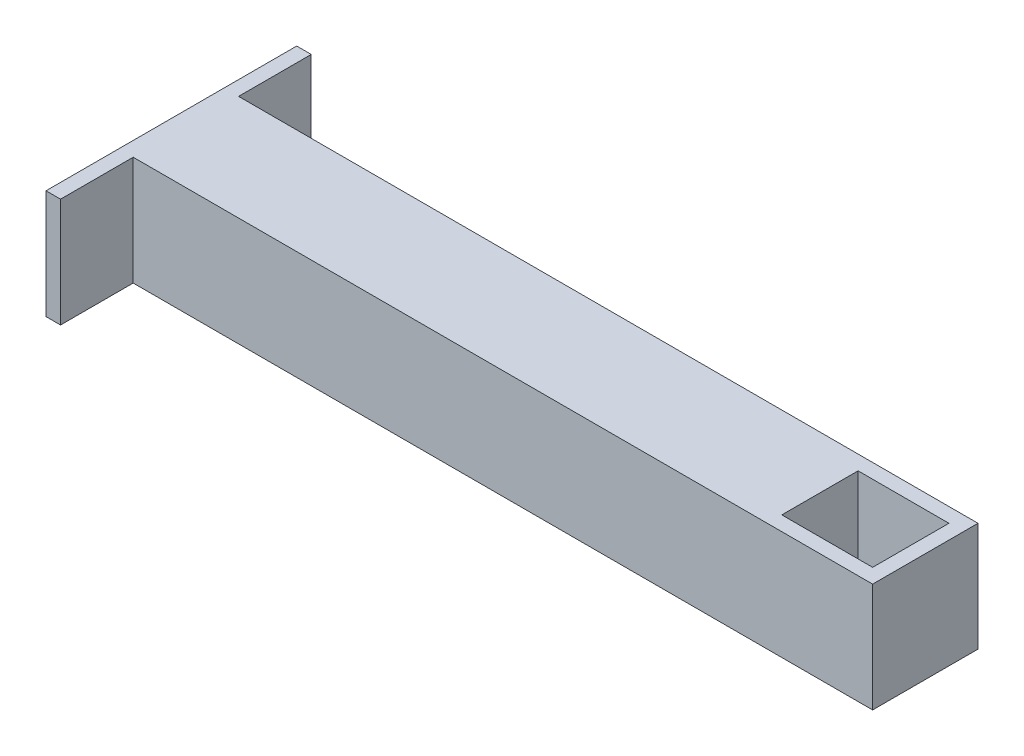
from build123d import *

# Parameters (mm, degrees)
SKETCH1_W           = 12.5
SKETCH1_H           = 10.5
BOSS_EXTRUDE2_DEPTH = 15


with BuildPart() as part:
    # Sketch1 → Boss-Extrude2 (new body)
    with BuildSketch(Plane(origin=(0, 0, 0), x_dir=(1, 0, 0), z_dir=(0, 1, 0))):
        Polygon((-87.25, -22.5), (-87.25, -12.5), (-2, -12.5), (14.5, -12.5), (14.5, 2), (-2, 2), (-87.25, 2), (-87.25, 12), (-89.25, 12), (-89.25, -22.5), align=None)
        with Locations((6.25, -5.25)):
            Rectangle(SKETCH1_W, SKETCH1_H, mode=Mode.SUBTRACT)
    extrude(amount=BOSS_EXTRUDE2_DEPTH)


solid = part.part
